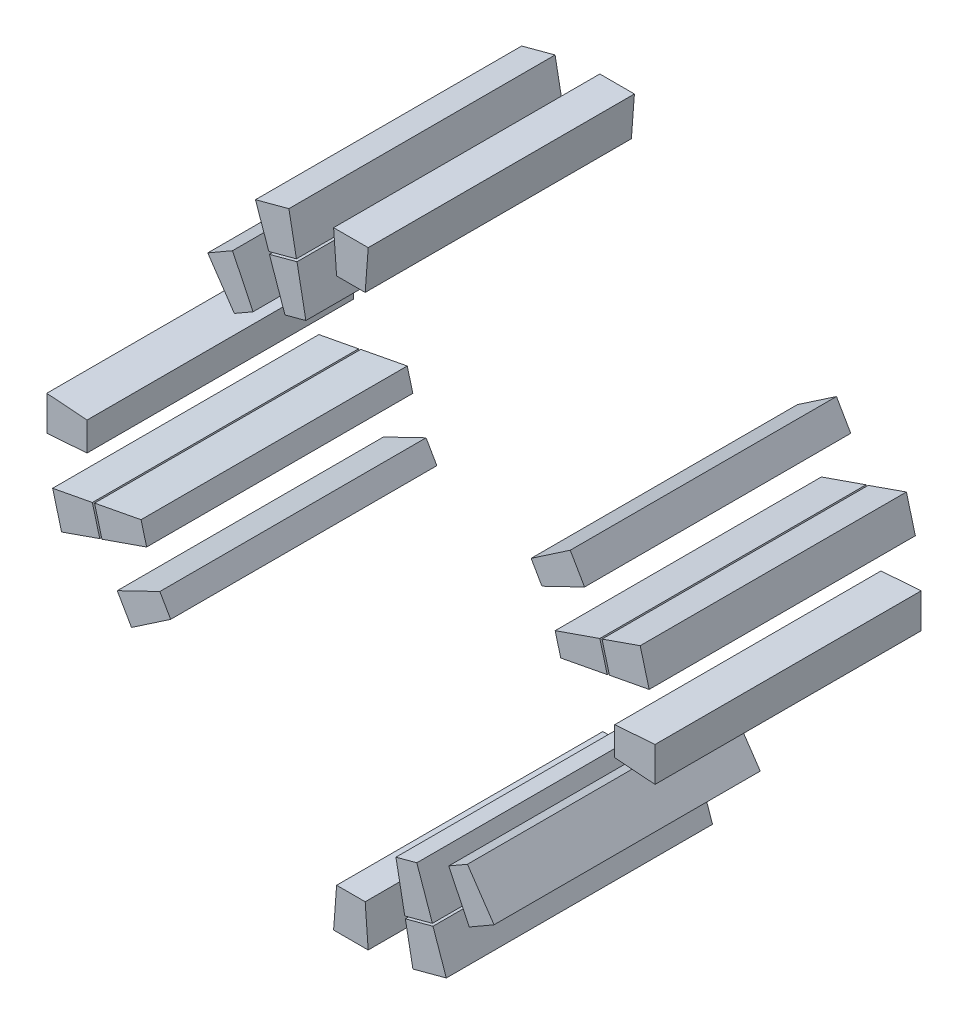
from build123d import *

# Parameters (mm, degrees)
COIL_SIDES_START    = -20
COIL_SIDES_DEPTH    = 40
COIL_SIDES_2_DEPTH  = 40
COIL_SIDES_3_DEPTH  = 40
COIL_SIDES_4_DEPTH  = 40
COIL_SIDES_5_DEPTH  = 40
COIL_SIDES_6_DEPTH  = 40
COIL_SIDES_7_DEPTH  = 40
COIL_SIDES_8_DEPTH  = 40
COIL_SIDES_9_DEPTH  = 40
COIL_SIDES_10_DEPTH = 40
COIL_SIDES_11_DEPTH = 40
COIL_SIDES_12_DEPTH = 40
COIL_SIDES_13_DEPTH = 40
COIL_SIDES_14_DEPTH = 40
COIL_SIDES_15_DEPTH = 40
COIL_SIDES_16_DEPTH = 40


with BuildPart() as part:
    # Эскиз1 → Coil_sides (new body)
    with BuildSketch(Plane.XY.offset(COIL_SIDES_START)):
        Polygon((39.64188455, -2.147321429), (45.7, -2.6), (45.7, 2.6), (39.64188455, 2.147321429), align=None)
    extrude(amount=COIL_SIDES_DEPTH)


with BuildPart() as body_2:
    # Эскиз1 → Coil_sides 2 (new body)
    with BuildSketch(Plane.XY.offset(COIL_SIDES_START)):
        Polygon((31.532118785, 6.766681971), (38.516652655, 8.097435247), (37.405117291, 12.245741698), (30.690956889, 9.905940906), align=None)
    extrude(amount=COIL_SIDES_2_DEPTH)


with BuildPart() as body_3:
    # Эскиз1 → Coil_sides 3 (new body)
    with BuildSketch(Plane.XY.offset(COIL_SIDES_START)):
        Polygon((38.846887771, 8.18592148), (44.815739779, 9.316623213), (43.469880744, 14.33943751), (37.735352408, 12.334227931), align=None)
    extrude(amount=COIL_SIDES_3_DEPTH)


with BuildPart() as body_4:
    # Эскиз1 → Coil_sides 4 (new body)
    with BuildSketch(Plane.XY.offset(COIL_SIDES_START)):
        Polygon((28.706341726, 14.697225748), (35.108459083, 17.790365093), (32.961137654, 21.509634907), (27.081341726, 17.511808311), align=None)
    extrude(amount=COIL_SIDES_4_DEPTH)


with BuildPart() as body_5:
    # Эскиз1 → Coil_sides 5 (new body)
    with BuildSketch(Plane.XY.offset(COIL_SIDES_START)):
        Polygon((2.147321429, 39.64188455), (2.6, 45.7), (-2.6, 45.7), (-2.147321429, 39.64188455), align=None)
    extrude(amount=COIL_SIDES_5_DEPTH)


with BuildPart() as body_6:
    # Эскиз1 → Coil_sides 6 (new body)
    with BuildSketch(Plane.XY.offset(COIL_SIDES_START)):
        Polygon((-6.766681971, 31.532118785), (-8.097435247, 38.516652655), (-12.245741698, 37.405117291), (-9.905940906, 30.690956889), align=None)
    extrude(amount=COIL_SIDES_6_DEPTH)


with BuildPart() as body_7:
    # Эскиз1 → Coil_sides 7 (new body)
    with BuildSketch(Plane.XY.offset(COIL_SIDES_START)):
        Polygon((-8.18592148, 38.846887771), (-9.316623213, 44.815739779), (-14.33943751, 43.469880744), (-12.334227931, 37.735352408), align=None)
    extrude(amount=COIL_SIDES_7_DEPTH)


with BuildPart() as body_8:
    # Эскиз1 → Coil_sides 8 (new body)
    with BuildSketch(Plane.XY.offset(COIL_SIDES_START)):
        Polygon((-14.697225748, 28.706341726), (-17.790365093, 35.108459083), (-21.509634907, 32.961137654), (-17.511808311, 27.081341726), align=None)
    extrude(amount=COIL_SIDES_8_DEPTH)


with BuildPart() as body_9:
    # Эскиз1 → Coil_sides 9 (new body)
    with BuildSketch(Plane.XY.offset(COIL_SIDES_START)):
        Polygon((-39.64188455, 2.147321429), (-45.7, 2.6), (-45.7, -2.6), (-39.64188455, -2.147321429), align=None)
    extrude(amount=COIL_SIDES_9_DEPTH)


with BuildPart() as body_10:
    # Эскиз1 → Coil_sides 10 (new body)
    with BuildSketch(Plane.XY.offset(COIL_SIDES_START)):
        Polygon((-31.532118785, -6.766681971), (-38.516652655, -8.097435247), (-37.405117291, -12.245741698), (-30.690956889, -9.905940906), align=None)
    extrude(amount=COIL_SIDES_10_DEPTH)


with BuildPart() as body_11:
    # Эскиз1 → Coil_sides 11 (new body)
    with BuildSketch(Plane.XY.offset(COIL_SIDES_START)):
        Polygon((-38.846887771, -8.18592148), (-44.815739779, -9.316623213), (-43.469880744, -14.33943751), (-37.735352408, -12.334227931), align=None)
    extrude(amount=COIL_SIDES_11_DEPTH)


with BuildPart() as body_12:
    # Эскиз1 → Coil_sides 12 (new body)
    with BuildSketch(Plane.XY.offset(COIL_SIDES_START)):
        Polygon((-28.706341726, -14.697225748), (-35.108459083, -17.790365093), (-32.961137654, -21.509634907), (-27.081341726, -17.511808311), align=None)
    extrude(amount=COIL_SIDES_12_DEPTH)


with BuildPart() as body_13:
    # Эскиз1 → Coil_sides 13 (new body)
    with BuildSketch(Plane.XY.offset(COIL_SIDES_START)):
        Polygon((-2.147321429, -39.64188455), (-2.6, -45.7), (2.6, -45.7), (2.147321429, -39.64188455), align=None)
    extrude(amount=COIL_SIDES_13_DEPTH)


with BuildPart() as body_14:
    # Эскиз1 → Coil_sides 14 (new body)
    with BuildSketch(Plane.XY.offset(COIL_SIDES_START)):
        Polygon((6.766681971, -31.532118785), (8.097435247, -38.516652655), (12.245741698, -37.405117291), (9.905940906, -30.690956889), align=None)
    extrude(amount=COIL_SIDES_14_DEPTH)


with BuildPart() as body_15:
    # Эскиз1 → Coil_sides 15 (new body)
    with BuildSketch(Plane.XY.offset(COIL_SIDES_START)):
        Polygon((8.18592148, -38.846887771), (9.316623213, -44.815739779), (14.33943751, -43.469880744), (12.334227931, -37.735352408), align=None)
    extrude(amount=COIL_SIDES_15_DEPTH)


with BuildPart() as body_16:
    # Эскиз1 → Coil_sides 16 (new body)
    with BuildSketch(Plane.XY.offset(COIL_SIDES_START)):
        Polygon((14.697225748, -28.706341726), (17.790365093, -35.108459083), (21.509634907, -32.961137654), (17.511808311, -27.081341726), align=None)
    extrude(amount=COIL_SIDES_16_DEPTH)


solid = Compound([part.part, body_2.part, body_3.part, body_4.part, body_5.part, body_6.part, body_7.part, body_8.part, body_9.part, body_10.part, body_11.part, body_12.part, body_13.part, body_14.part, body_15.part, body_16.part])
